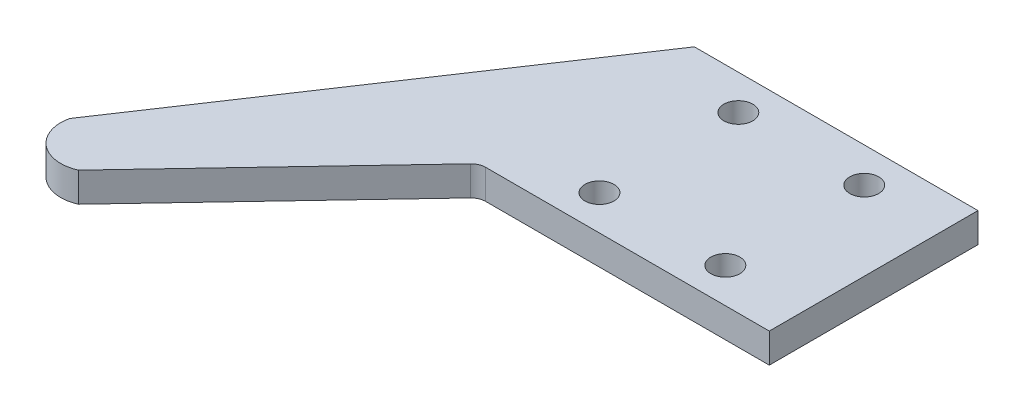
from build123d import *

# Parameters (mm, degrees)
BOSS_EXTRUDE1_DEPTH    = 5.08
F_10_CLEARANCE_HOLE1_D = 4.9784


with BuildPart() as part:
    # Sketch1 → Boss-Extrude1 (new body)
    with BuildSketch(Plane(origin=(0, 0, 0), x_dir=(1, 0, 0), z_dir=(0, 1, 0))):
        with BuildLine():
            Line((27.234807671, -40.223012788), (-5.482691703, -74.830900036))
            ThreePointArc((-5.482691703, -74.830900036), (-11.874952903, -74.014978741), (-13.943081074, -67.911735613))
            Line((-13.943081074, -67.911735613), (29.080561657, -3.550446088))
            Line((29.080561657, -3.550446088), (77.831071682, -3.550446088))
            Line((77.831071682, -3.550446088), (77.831071682, -39.427946088))
            Line((77.831071682, -39.427946088), (29.080561657, -39.427946088))
            ThreePointArc((29.080561657, -39.427946088), (28.075706091, -39.635165496), (27.234807671, -40.223012788))
        make_face()
    extrude(amount=BOSS_EXTRUDE1_DEPTH)

    # #10 Clearance Hole1 (through all)
    with Locations(Plane(origin=(0, 5.08, 0), x_dir=(1, 0, 0), z_dir=(0, 1, 0))):
        with Locations((42.63541667, -33.427196088), (42.63541667, -9.551196088), (64.27621667, -9.551196088), (64.27621667, -33.427196088)):
            Hole(F_10_CLEARANCE_HOLE1_D / 2)


solid = part.part
